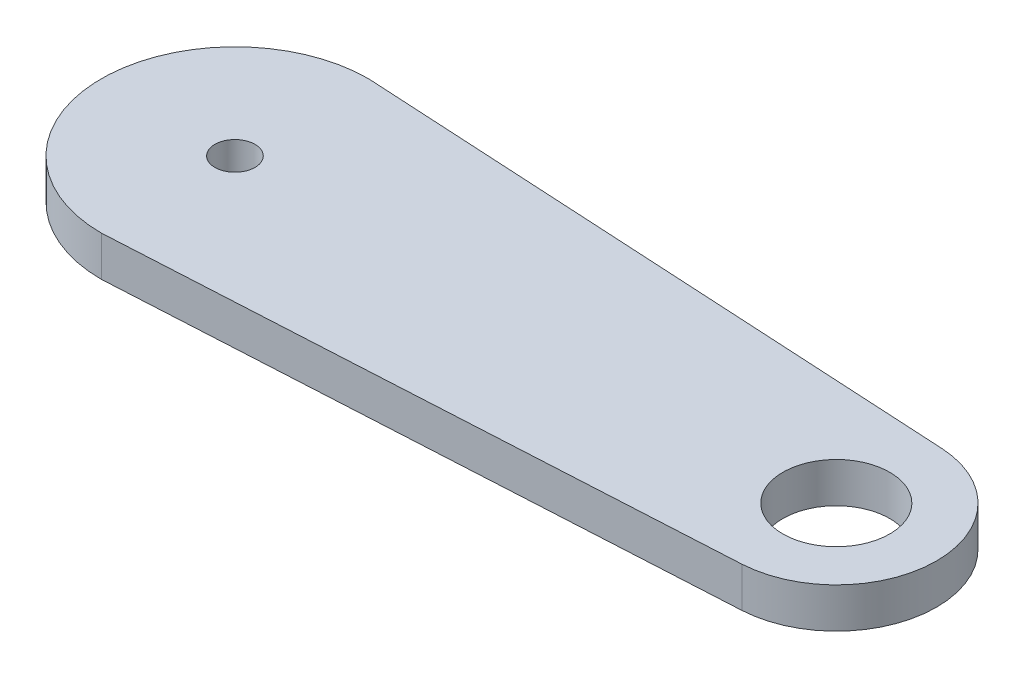
from build123d import *

# Parameters (mm, degrees)
BOSS_EXTRUDE1_DEPTH = 3
CUT_EXTRUDE1_REACH  = 55.528
SKETCH2_R           = 1.5
SKETCH2_R_2         = 4


with BuildPart() as part:
    # Sketch1 → Boss-Extrude1 (new body)
    with BuildSketch(Plane(origin=(0, 0, 0), x_dir=(1, 0, 0), z_dir=(0, 1, 0))):
        with BuildLine():
            ThreePointArc((0, 10), (-10, 0), (0, -10))
            Line((0, -10), (45.414124006, -7.488558026))
            ThreePointArc((45.414124006, -7.488558026), (52.5, 0), (45.414124006, 7.488558026))
            Line((45.414124006, 7.488558026), (0, 10))
        make_face()
    extrude(amount=BOSS_EXTRUDE1_DEPTH)

    # Sketch2 → Cut-Extrude1 (cut, up to next)
    with BuildSketch(Plane(origin=(0, 3, 0), x_dir=(1, 0, 0), z_dir=(0, 1, 0)), mode=Mode.PRIVATE) as cut_extrude1_sk1:
        with Locations(Location((0, 0, 0), (0, 0, 270))):
            Circle(SKETCH2_R)
    cut_extrude1_tool1 = extrude(cut_extrude1_sk1.sketch, amount=-CUT_EXTRUDE1_REACH, mode=Mode.PRIVATE) & part.part
    # Sketch2 → Cut-Extrude1 (cut, up to next)
    with BuildSketch(Plane(origin=(0, 3, 0), x_dir=(1, 0, 0), z_dir=(0, 1, 0)), mode=Mode.PRIVATE) as cut_extrude1_sk2:
        with Locations(Location((45, 0, 0), (0, 0, 270))):
            Circle(SKETCH2_R_2)
    cut_extrude1_tool2 = extrude(cut_extrude1_sk2.sketch, amount=-CUT_EXTRUDE1_REACH, mode=Mode.PRIVATE) & part.part
    add(cut_extrude1_tool1.solids().sort_by_distance((0, 3, 0))[0], mode=Mode.SUBTRACT)
    add(cut_extrude1_tool2.solids().sort_by_distance((45, 3, 0))[0], mode=Mode.SUBTRACT)


solid = part.part
